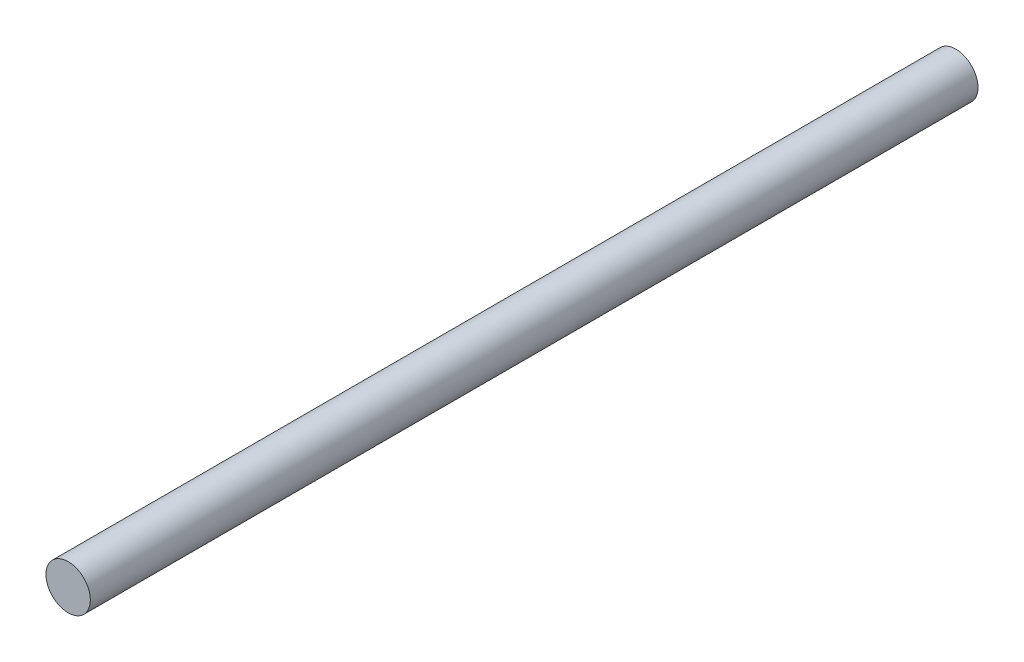
from build123d import *

# Parameters (mm, degrees)
SKETCH1_R           = 1.5875
BOSS_EXTRUDE1_DEPTH = 63.5


with BuildPart() as part:
    # Sketch1 → Boss-Extrude1 (new body)
    with BuildSketch(Plane.XY):
        Circle(SKETCH1_R)
    extrude(amount=BOSS_EXTRUDE1_DEPTH)


solid = part.part
